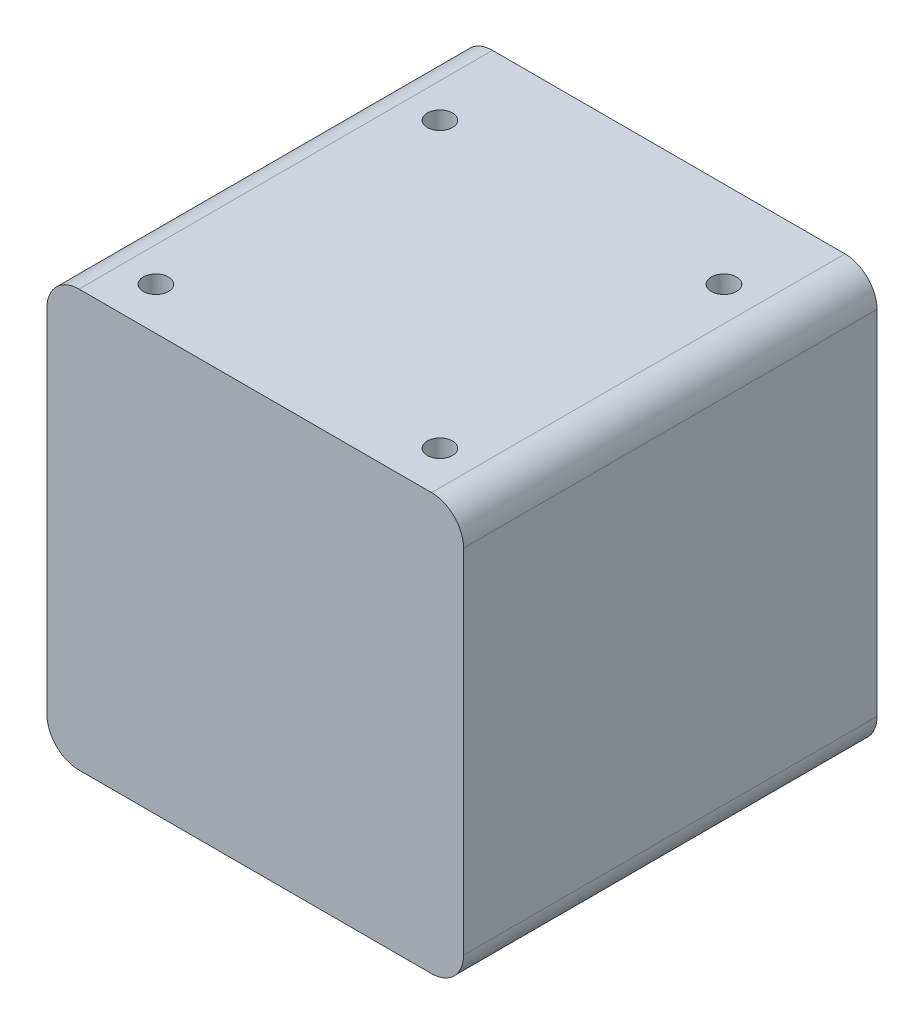
from build123d import *

# Parameters (mm, degrees)
SKETCH1_W                 = 26.4
SKETCH1_H                 = 26.4
BOSS_EXTRUDE1_DEPTH       = 26.2
FILLET1_R                 = 2.032
SKETCH5_R                 = 12.626192159
CUT_EXTRUDE3_DEPTH        = 2.5
M2X0_4_TAPPED_HOLE1_D     = 1.6
M2X0_4_TAPPED_HOLE1_DEPTH = 5.334
M2X0_4_TAPPED_HOLE2_D     = 1.6
M2X0_4_TAPPED_HOLE2_DEPTH = 5.334


with BuildPart() as part:
    # Sketch1 → Boss-Extrude1 (new body)
    with BuildSketch(Plane.XY):
        Rectangle(SKETCH1_W, SKETCH1_H)
    extrude(amount=BOSS_EXTRUDE1_DEPTH)

    # Fillet1
    fillet1_edges = [part.edges().sort_by_distance(p)[0] for p in [
        (-13.2, 13.2, 13.1),
        (13.2, 13.2, 13.1),
        (13.2, -13.2, 13.1),
        (-13.2, -13.2, 13.1),
    ]]
    fillet(fillet1_edges, radius=FILLET1_R)

    # Sketch5 → Cut-Extrude3 (cut)
    with BuildSketch(Plane(origin=(0, 0, 0), x_dir=(-1, 0, 0), z_dir=(0, 0, -1))):
        Circle(SKETCH5_R)
    extrude(amount=-CUT_EXTRUDE3_DEPTH, mode=Mode.SUBTRACT)

    # M2x0.4 Tapped Hole1
    with Locations(Plane(origin=(0, -13.2, 0), x_dir=(-1, 0, 0), z_dir=(0, -1, 0))):
        with Locations((9, -23.5), (9, -5.5), (-9, -5.5), (-9, -23.5)):
            Hole(M2X0_4_TAPPED_HOLE1_D / 2, depth=M2X0_4_TAPPED_HOLE1_DEPTH)

    # M2x0.4 Tapped Hole2
    with Locations(Plane(origin=(0, 13.2, 0), x_dir=(1, 0, 0), z_dir=(0, 1, 0))):
        with Locations((9, -5.5), (9, -23.5), (-9, -23.5), (-9, -5.5)):
            Hole(M2X0_4_TAPPED_HOLE2_D / 2, depth=M2X0_4_TAPPED_HOLE2_DEPTH)


solid = part.part
